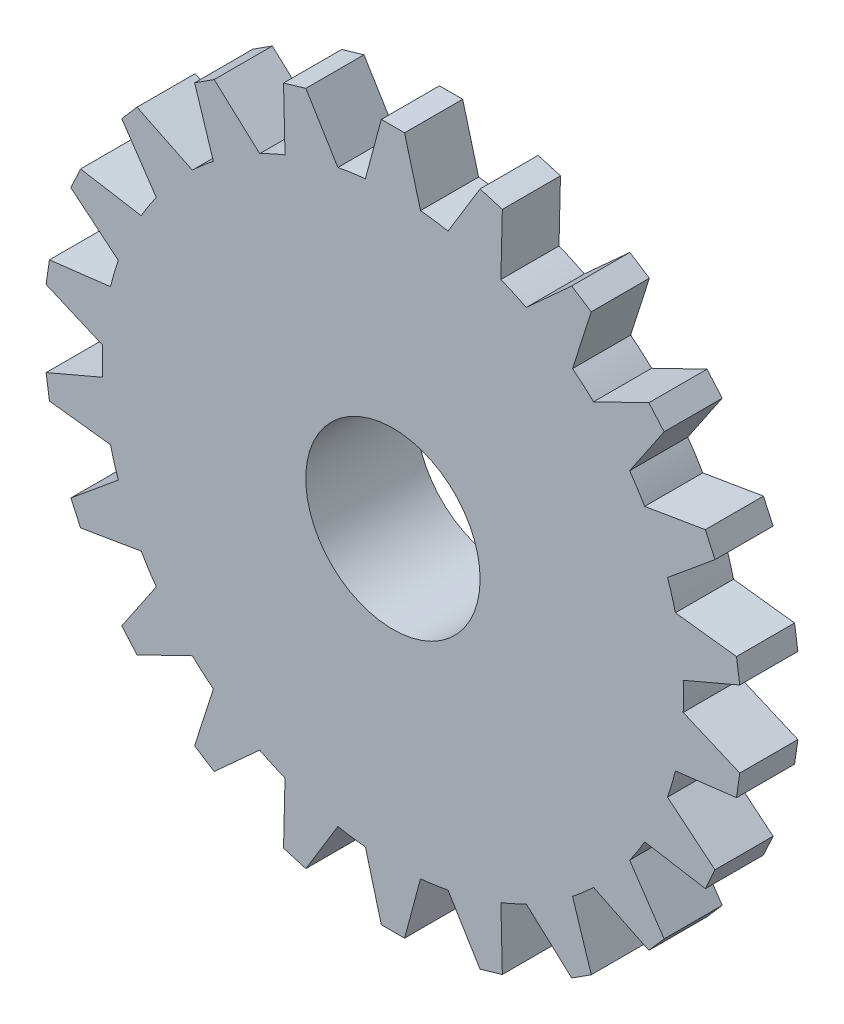
from build123d import *

# Parameters (mm, degrees)
SKETCH3_R            = 12.7
BOSS_EXTRUDE2_DEPTH  = 2.54
BOSS_EXTRUDE4_DEPTH  = 2.54
CIRPATTERN1_COUNT    = 22
SKETCH5_R            = 11.43
BOSS_EXTRUDE6_DEPTH  = 0.254
SKETCH6_R            = 3.81
CUT_EXTRUDE1_DEPTH   = 16.08
SKETCH8_R            = 11.43
CUT_EXTRUDE2_DEPTH   = 0.254
SKETCH9_R            = 5.08
BOSS_EXTRUDE11_DEPTH = 2.54
CUT_EXTRUDE3_START   = -2.54
SKETCH10_R           = 3.81
CUT_EXTRUDE3_DEPTH   = 2.54


with BuildPart() as part:
    # Sketch3 → Boss-Extrude2 (new body)
    with BuildSketch(Plane.XY):
        Circle(SKETCH3_R)
    boss_extrude2 = extrude(amount=BOSS_EXTRUDE2_DEPTH)

    # Sketch4 → Boss-Extrude4 (add)
    with BuildSketch(Plane.XY.offset(2.54)):
        Polygon((-0.508, 15.24), (0.508, 15.24), (1.657370651, 10.950490333), (-1.657370651, 10.950490333), align=None)
    boss_extrude4 = extrude(amount=-BOSS_EXTRUDE4_DEPTH)

    # CirPattern1: Boss-Extrude2, Boss-Extrude4 ×22 about axis
    cirpattern1_axis = Axis((0, 0, 0), (0, 0, 1))
    add([boss_extrude2.rotate(cirpattern1_axis, i * 360 / CIRPATTERN1_COUNT) for i in range(1, CIRPATTERN1_COUNT)])
    add([boss_extrude4.rotate(cirpattern1_axis, i * 360 / CIRPATTERN1_COUNT) for i in range(1, CIRPATTERN1_COUNT)])

    # Sketch5 → Boss-Extrude6 (add)
    with BuildSketch(Plane(origin=(0, 0, 0), x_dir=(-1, 0, 0), z_dir=(0, 0, -1))):
        Circle(SKETCH5_R)
    extrude(amount=-BOSS_EXTRUDE6_DEPTH)

    # Sketch6 → Cut-Extrude1 (cut)
    with BuildSketch(Plane.XY.offset(2.54)):
        Circle(SKETCH6_R)
    extrude(amount=-CUT_EXTRUDE1_DEPTH, mode=Mode.SUBTRACT)

    # Sketch8 → Cut-Extrude2 (cut)
    with BuildSketch(Plane(origin=(0, 0, 0), x_dir=(-1, 0, 0), z_dir=(0, 0, -1))):
        Circle(SKETCH8_R)
    extrude(amount=-CUT_EXTRUDE2_DEPTH, mode=Mode.SUBTRACT)

    # Sketch9 → Boss-Extrude11 (add)
    with BuildSketch(Plane(origin=(0, 0, 0.254), x_dir=(-1, 0, 0), z_dir=(0, 0, -1))):
        Circle(SKETCH9_R)
    extrude(amount=BOSS_EXTRUDE11_DEPTH)

    # Sketch10 → Cut-Extrude3 (cut)
    with BuildSketch(Plane(origin=(0, 0, -2.286), x_dir=(-1, 0, 0), z_dir=(0, 0, -1)).offset(CUT_EXTRUDE3_START)):
        with Locations(Location((0, 0, 0), (0, 0, 180))):
            Circle(SKETCH10_R)
    extrude(amount=CUT_EXTRUDE3_DEPTH, mode=Mode.SUBTRACT)


solid = part.part
